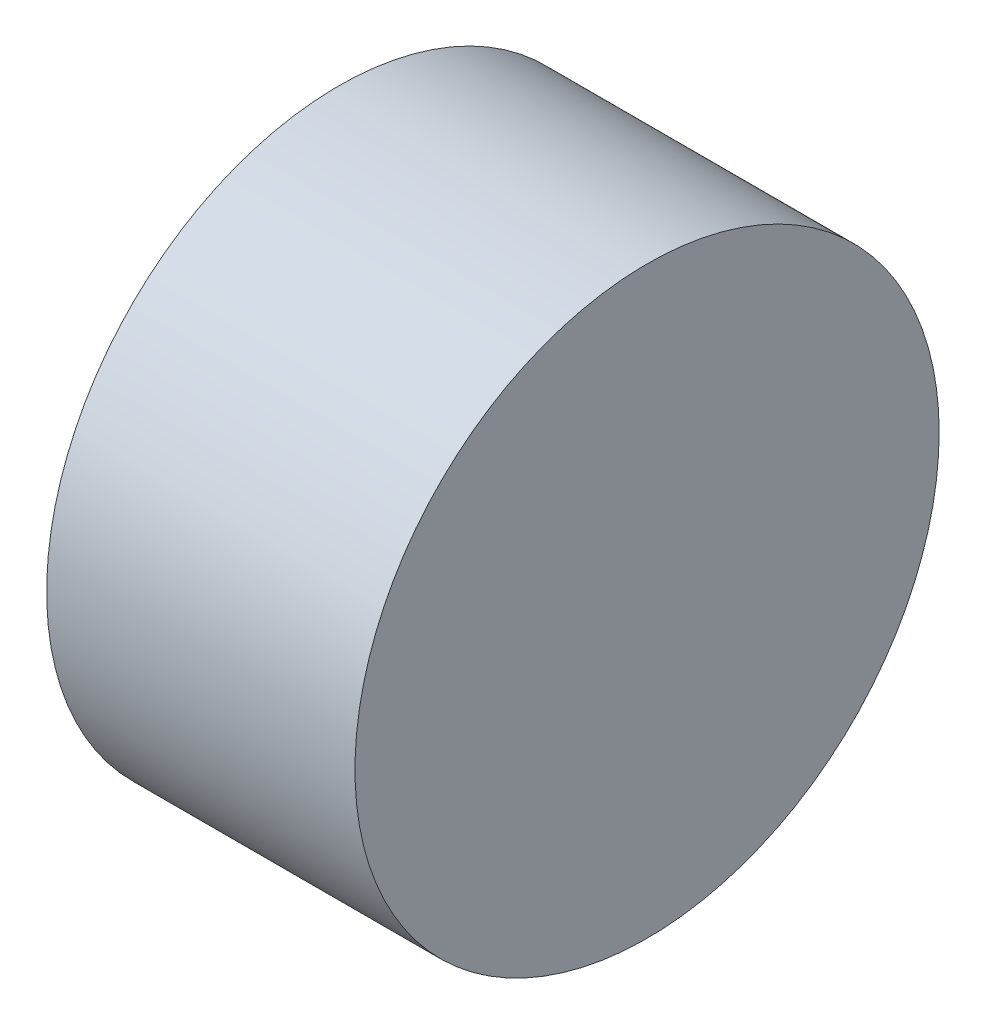
from build123d import *

# Parameters (mm, degrees)
SKETCH1_R           = 36
BOSS_EXTRUDE1_DEPTH = 38


with BuildPart() as part:
    # Sketch1 → Boss-Extrude1 (new body)
    with BuildSketch(Plane(origin=(0, 0, 0), x_dir=(0, 0, -1), z_dir=(1, 0, 0))):
        Circle(SKETCH1_R)
    extrude(amount=BOSS_EXTRUDE1_DEPTH)


solid = part.part
